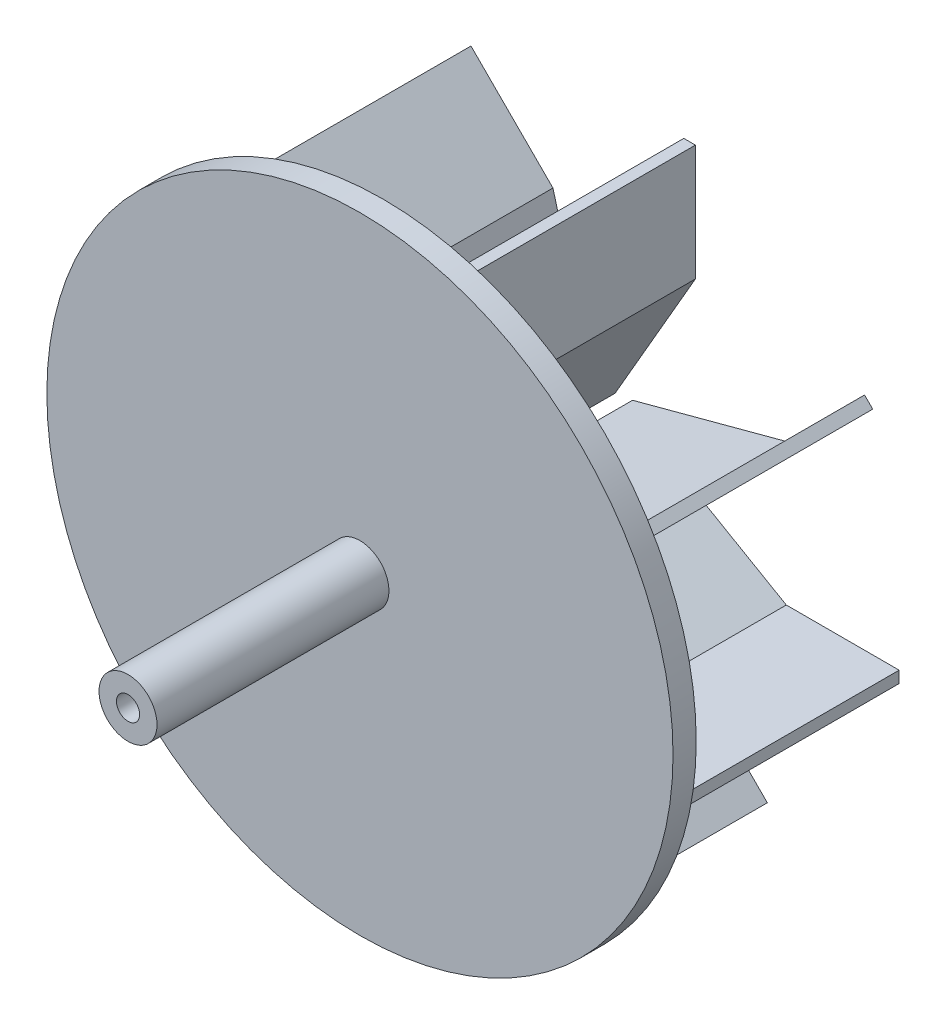
from build123d import *

# Parameters (mm, degrees)
SKETCH_1_R          = 27
EXTRUDE_1_DEPTH     = 2
EXTRUDE_2_DEPTH     = 20
SKETCH_3_R          = 2.5
EXTRUDE_3_DEPTH     = 20
SKETCH_4_R          = 1
CUT_EXTRUDE_1_DEPTH = 15


with BuildPart() as part:
    # 草图1 → 凸台-拉伸1 (new body)
    with BuildSketch(Plane.XY):
        Circle(SKETCH_1_R)
    extrude(amount=EXTRUDE_1_DEPTH)

    # 草图2 → 凸台-拉伸2 (add)
    with BuildSketch(Plane.XY):
        Polygon((-2.5, 0), (-14.5, 6.92820323), (-24.5, 6.92820323), (-24.5, 5.92820323), (-14.767949192, 5.92820323), (-3, -0.866025404), align=None)
        Polygon((-12.425136654, 22.223095625), (-13.132243435, 21.515988843), (-6.250644314, 14.634389723), (-2.733692779, 1.508947908), (-1.767766953, 1.767766953), (-5.354068842, 15.152027813), align=None)
        Polygon((6.92820323, 24.5), (5.92820323, 24.5), (5.92820323, 14.767949192), (-0.866025404, 3), (0, 2.5), (6.92820323, 14.5), align=None)
        Polygon((22.223095625, 12.425136654), (21.515988843, 13.132243435), (14.634389723, 6.250644314), (1.508947908, 2.733692779), (1.767766953, 1.767766953), (15.152027813, 5.354068842), align=None)
        Polygon((24.5, -6.92820323), (24.5, -5.92820323), (14.767949192, -5.92820323), (3, 0.866025404), (2.5, 0), (14.5, -6.92820323), align=None)
        Polygon((12.425136654, -22.223095625), (13.132243435, -21.515988843), (6.250644314, -14.634389723), (2.733692779, -1.508947908), (1.767766953, -1.767766953), (5.354068842, -15.152027813), align=None)
        Polygon((-6.92820323, -24.5), (-5.92820323, -24.5), (-5.92820323, -14.767949192), (0.866025404, -3), (0, -2.5), (-6.92820323, -14.5), align=None)
        Polygon((-22.223095625, -12.425136654), (-21.515988843, -13.132243435), (-14.634389723, -6.250644314), (-1.508947908, -2.733692779), (-1.767766953, -1.767766953), (-15.152027813, -5.354068842), align=None)
    extrude(amount=-EXTRUDE_2_DEPTH)

    # 草图3 → 凸台-拉伸3 (add)
    with BuildSketch(Plane.XY.offset(2)):
        Circle(SKETCH_3_R)
    extrude(amount=EXTRUDE_3_DEPTH)

    # 草图4 → 切除-拉伸1 (cut)
    with BuildSketch(Plane.XY.offset(22)):
        Circle(SKETCH_4_R)
    extrude(amount=-CUT_EXTRUDE_1_DEPTH, mode=Mode.SUBTRACT)


solid = part.part
